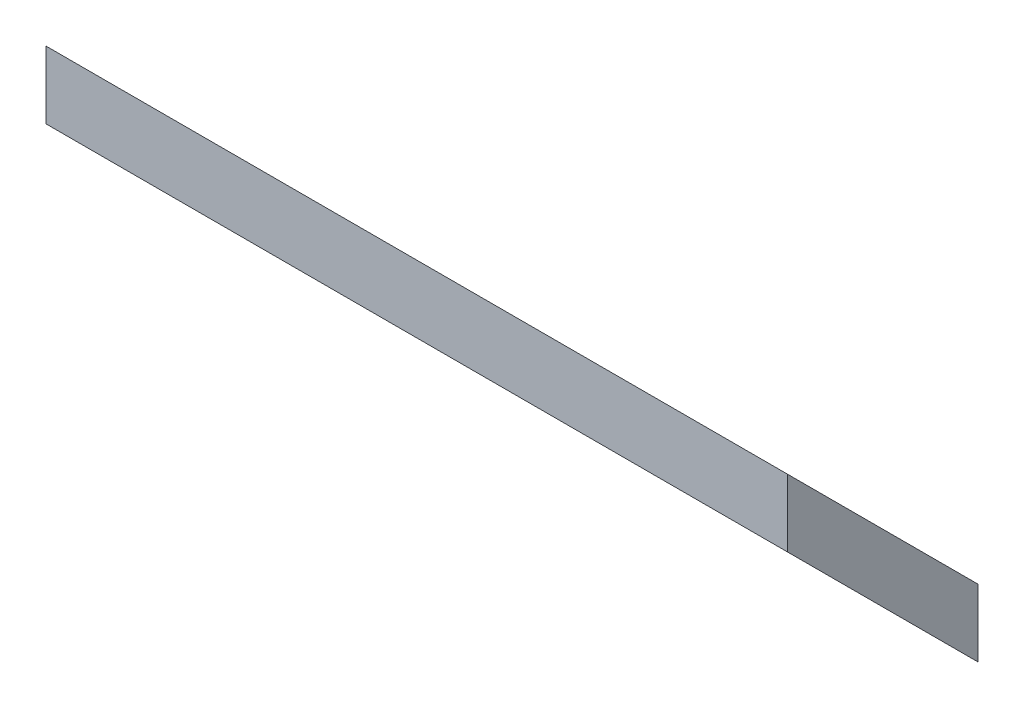
from build123d import *

# Parameters (mm, degrees)
SKETCH1_W = 139.7
SKETCH1_H = 12.7


with BuildPart() as part:
    # Sweep1: sweep along a path in Sketch2
    with BuildLine(Plane(origin=(0, 0, 0), x_dir=(0, 0, -1), z_dir=(1, 0, 0))) as sweep1_path:
        Line((0, 0), (-35.921024484, 35.921024484))
    # Sketch1 → Sweep1 (sweep)
    with BuildSketch(Plane.XY):
        with Locations((0, 6.35)):
            Rectangle(SKETCH1_W, SKETCH1_H)
    sweep(path=sweep1_path.line)


solid = part.part
